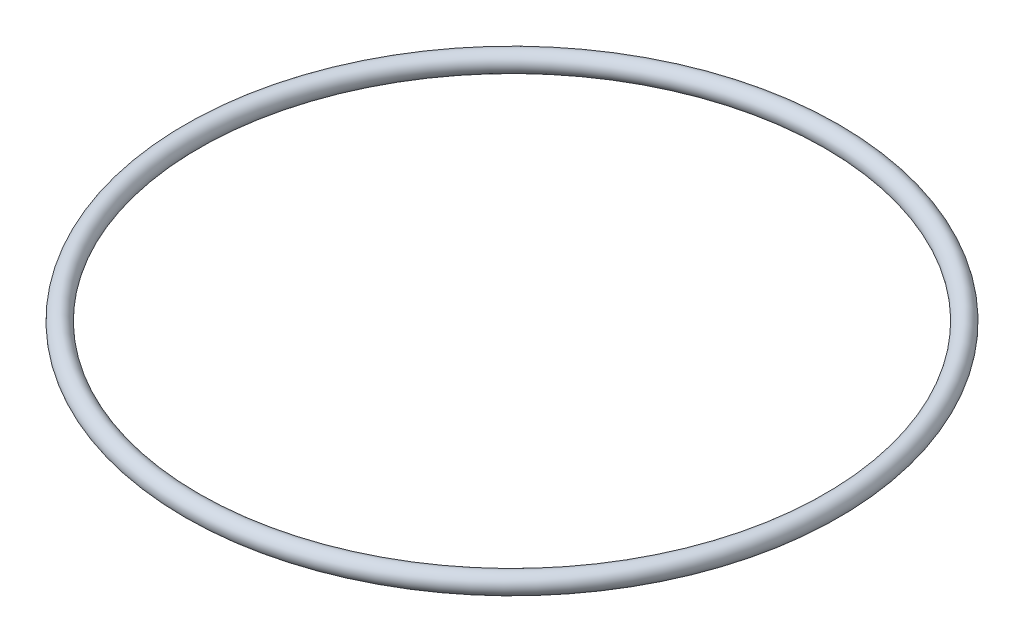
from build123d import *

# Parameters (mm, degrees)
SWEEP_1_PROFILE_R = 0.5


with BuildPart() as part:
    # 扫描1: sweep along a path in 草图1
    with BuildLine(Plane(origin=(0, 0, 0), x_dir=(1, 0, 0), z_dir=(0, 1, 0))) as sweep_1_path:
        CenterArc((0, 0), 16.5, 0, 360)
    # 扫描1 profile (on start of the path) → 扫描1 (sweep)
    with BuildSketch(Plane(origin=(16.5, 0, 0), x_dir=(-1, 0, 0), z_dir=(0, 0, -1))):
        Circle(SWEEP_1_PROFILE_R)
    sweep(path=sweep_1_path.line)


solid = part.part
